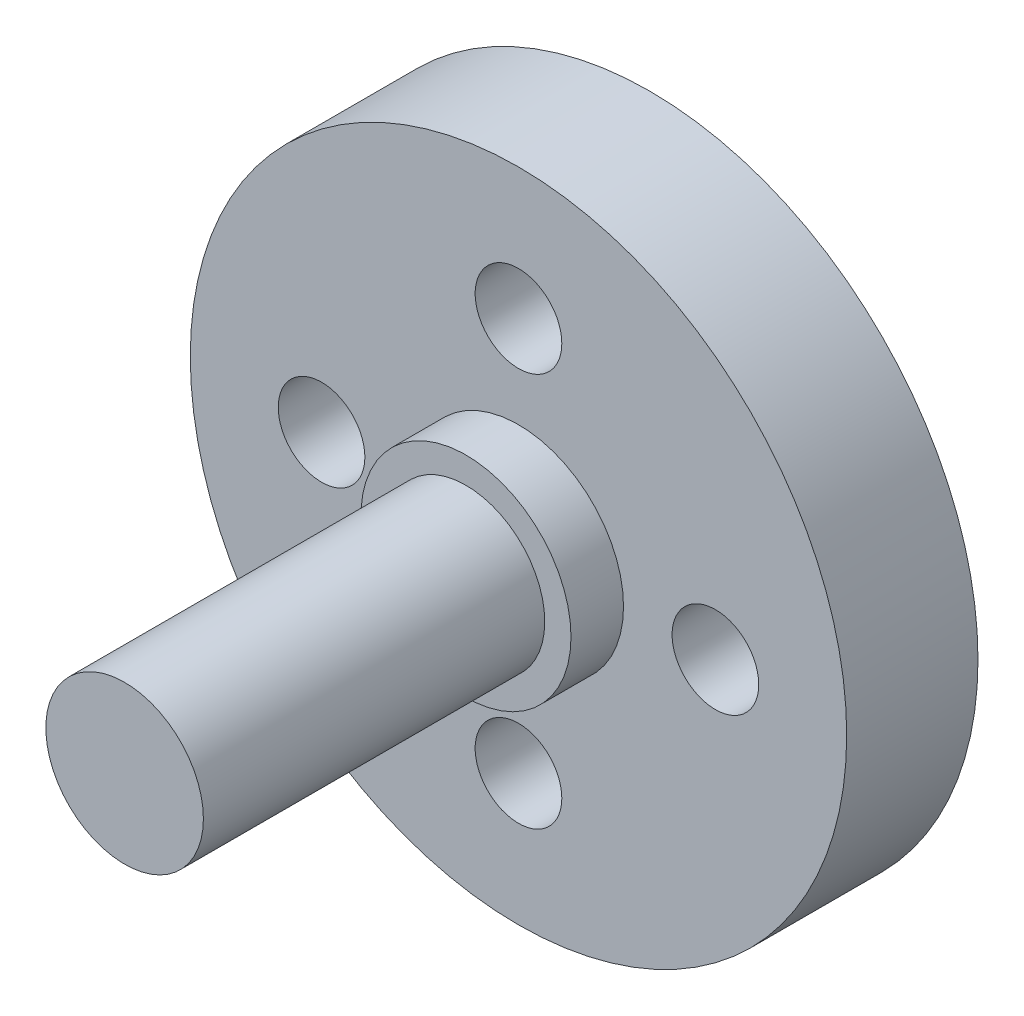
from build123d import *

# Parameters (mm, degrees)
SKETCH_1_R          = 12.5
EXTRUDE_1_DEPTH     = 5
SKETCH_2_R          = 4
EXTRUDE_2_DEPTH     = 2
SKETCH_3_R          = 3
EXTRUDE_3_DEPTH     = 13
SKETCH_4_R          = 1.65
CUT_EXTRUDE_1_DEPTH = 24.184046239


with BuildPart() as part:
    # ｽｹｯﾁ1 → ﾎﾞｽ - 押し出し1 (new body)
    with BuildSketch(Plane.XY):
        Circle(SKETCH_1_R)
    extrude(amount=EXTRUDE_1_DEPTH)

    # ｽｹｯﾁ2 → ﾎﾞｽ - 押し出し2 (add)
    with BuildSketch(Plane.XY.offset(5)):
        Circle(SKETCH_2_R)
    extrude(amount=EXTRUDE_2_DEPTH)

    # ｽｹｯﾁ3 → ﾎﾞｽ - 押し出し3 (add)
    with BuildSketch(Plane.XY.offset(7)):
        Circle(SKETCH_3_R)
    extrude(amount=EXTRUDE_3_DEPTH)

    # ｽｹｯﾁ4 → ｶｯﾄ - 押し出し1 (cut, through all)
    with BuildSketch(Plane.XY.offset(5)):
        with Locations((0, 7.5)):
            Circle(SKETCH_4_R)
        with Locations((7.5, 0)):
            Circle(SKETCH_4_R)
        with Locations((0, -7.5)):
            Circle(SKETCH_4_R)
        with Locations((-7.5, 0)):
            Circle(SKETCH_4_R)
    extrude(amount=-CUT_EXTRUDE_1_DEPTH, mode=Mode.SUBTRACT)


solid = part.part
